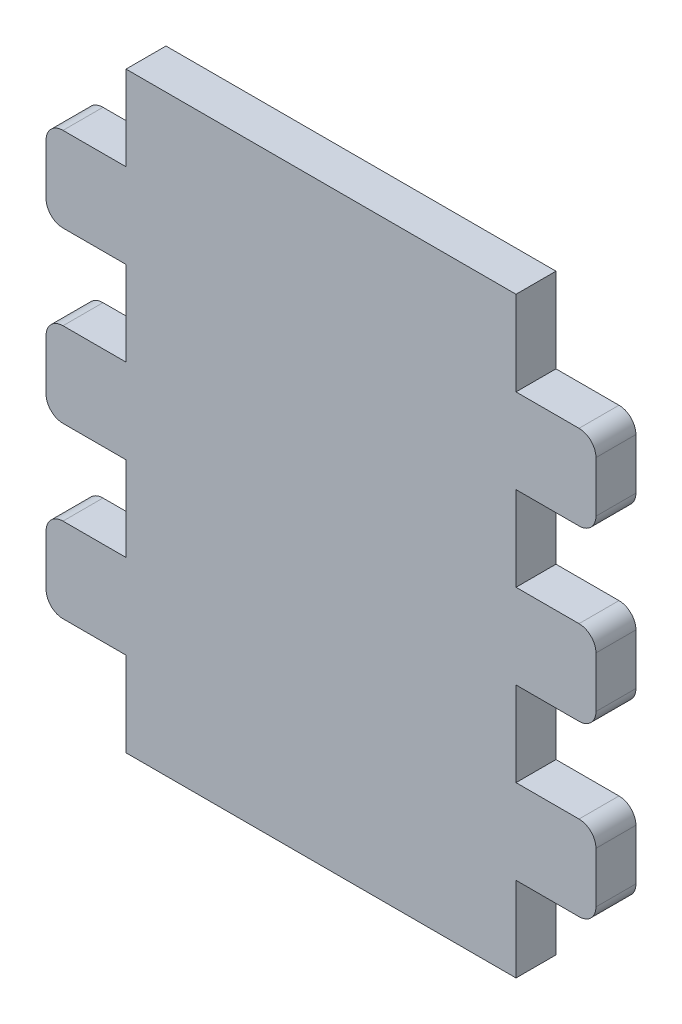
from build123d import *

# Parameters (mm, degrees)
SKETCH1_W               = 29.275000124
SKETCH1_H               = 44.45
BOSS_EXTRUDE1_DEPTH     = 3
SKETCH2_W               = 3
SKETCH2_H               = 6.35
BOSS_EXTRUDE2_DEPTH     = 6
LPATTERN1_COUNT         = 3
LPATTERN1_PITCH         = 12.7
MIRROR1_COPY_1_SKETCH_W = 3
MIRROR1_COPY_1_SKETCH_H = 6.35
MIRROR1_COPY_1_DEPTH    = 6
MIRROR1_COPY_2_SKETCH_W = 3
MIRROR1_COPY_2_SKETCH_H = 6.35
MIRROR1_COPY_2_DEPTH    = 6
FILLET1_R               = 1.27


with BuildPart() as part:
    # Sketch1 → Boss-Extrude1 (new body)
    with BuildSketch(Plane.XY):
        Rectangle(SKETCH1_W, SKETCH1_H)
    extrude(amount=BOSS_EXTRUDE1_DEPTH)

    # Sketch2 → Boss-Extrude2 (add)
    with BuildSketch(Plane(origin=(14.637500062, 0, 0), x_dir=(0, 0, -1), z_dir=(1, 0, 0))):
        with Locations((-1.5, -12.7)):
            Rectangle(SKETCH2_W, SKETCH2_H)
    boss_extrude2 = extrude(amount=BOSS_EXTRUDE2_DEPTH)

    # LPattern1: Boss-Extrude2 ×3
    with Locations(*[(0, i * LPATTERN1_PITCH, 0) for i in range(1, LPATTERN1_COUNT)]):
        add(boss_extrude2)

    # Mirror1: Boss-Extrude2 across plane
    add(boss_extrude2.mirror(Plane(origin=(0, 0, 0), x_dir=(0, 0, 1), z_dir=(1, 0, 0))))

    # Mirror1 copy 1 sketch → Mirror1 copy 1 (add)
    with BuildSketch(Plane(origin=(-14.637500062, 12.7, 0), x_dir=(0, 0, -1), z_dir=(-1, 0, 0))):
        with Locations((-1.5, 12.7)):
            Rectangle(MIRROR1_COPY_1_SKETCH_W, MIRROR1_COPY_1_SKETCH_H)
    extrude(amount=MIRROR1_COPY_1_DEPTH)

    # Mirror1 copy 2 sketch → Mirror1 copy 2 (add)
    with BuildSketch(Plane(origin=(-14.637500062, 25.4, 0), x_dir=(0, 0, -1), z_dir=(-1, 0, 0))):
        with Locations((-1.5, 12.7)):
            Rectangle(MIRROR1_COPY_2_SKETCH_W, MIRROR1_COPY_2_SKETCH_H)
    extrude(amount=MIRROR1_COPY_2_DEPTH)

    # Fillet1
    fillet1_edges = [part.edges().sort_by_distance(p)[0] for p in [
        (20.637500062, -15.875, 1.5),
        (20.637500062, -9.525, 1.5),
        (20.637500062, -3.175, 1.5),
        (20.637500062, 3.175, 1.5),
        (20.637500062, 9.525, 1.5),
        (20.637500062, 15.875, 1.5),
        (-20.637500062, -9.525, 1.5),
        (-20.637500062, -15.875, 1.5),
        (-20.637500062, 3.175, 1.5),
        (-20.637500062, -3.175, 1.5),
        (-20.637500062, 15.875, 1.5),
        (-20.637500062, 9.525, 1.5),
    ]]
    fillet(fillet1_edges, radius=FILLET1_R)


solid = part.part
